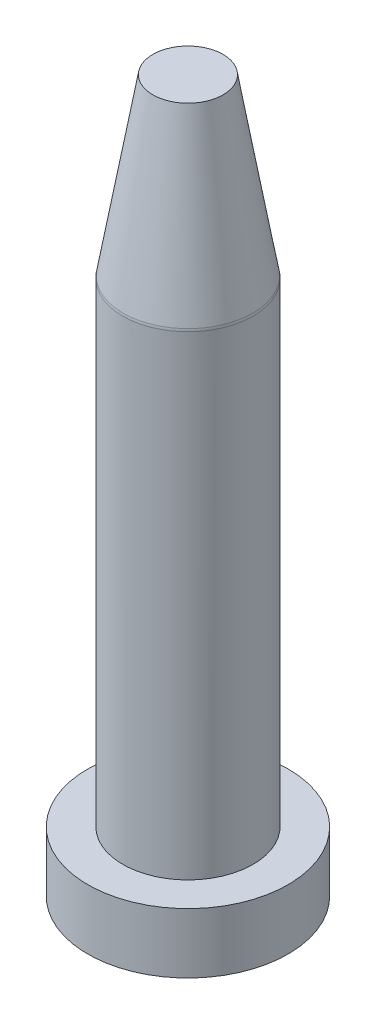
from build123d import *

# Parameters (mm, degrees)
FILLET_1_R = 3


with BuildPart() as part:
    # 草图1 → Revolve 333 (revolve)
    with BuildSketch(Plane.XY, mode=Mode.PRIVATE) as revolve_333_sk:
        Polygon((0, 0), (20, 0), (20, 12), (13, 12), (13, 107), (7, 142), (0, 142), align=None)
    revolve(revolve_333_sk.sketch.rotate(Axis((0, 0, 0), (0, 1, 0)), 90), axis=Axis((0, 0, 0), (0, 1, 0)))

    # 圆角1
    fillet_1_edges = [part.edges().sort_by_distance(p)[0] for p in [
        (0, 107, 13),
    ]]
    fillet(fillet_1_edges, radius=FILLET_1_R)


solid = part.part
